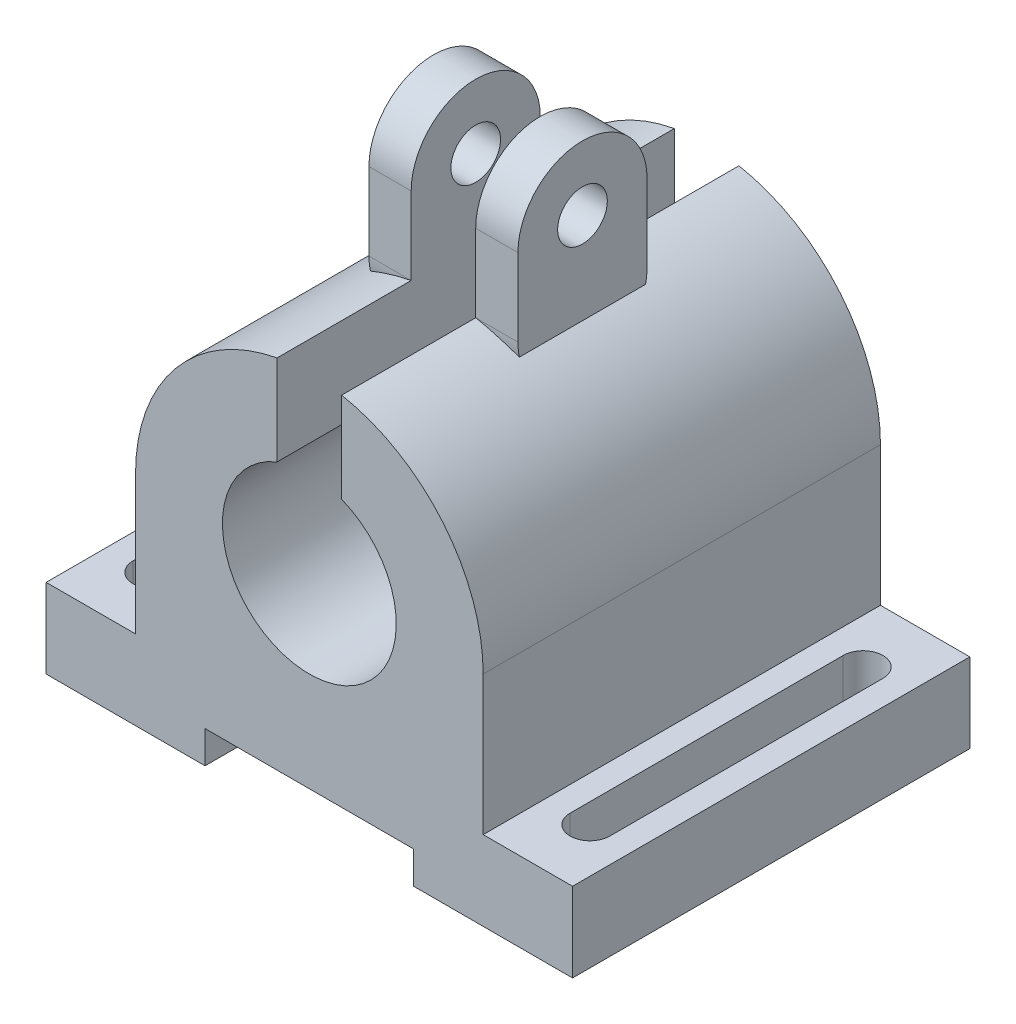
from build123d import *

# Parameters (mm, degrees)
BOSS_EXTRUDE1_DEPTH        = 80
BOSS_EXTRUDE3_DEPTH        = 8.5
BOSS_EXTRUDE4_START        = -8.5
BOSS_EXTRUDE4_DEPTH        = 8.5
F_10_0_10_DIAMETER_HOLE1_D = 10
CUT_EXTRUDE1_DEPTH         = 133.249763765


with BuildPart() as part:
    # Sketch2 → Boss-Extrude1 (new body)
    with BuildSketch(Plane.XY):
        with BuildLine():
            Line((-21, -37.5), (0, -37.5))
            Line((0, -37.5), (0, -17.5))
            ThreePointArc((0, -17.5), (-15.231429157, -8.617050879), (-15, 9.013878189))
            ThreePointArc((-15, 9.013878189), (-11.342217923, 13.326818547), (-6.5, 16.248076809))
            Line((-6.5, 16.248076809), (-6.5, 34.391132578))
            ThreePointArc((-6.5, 34.391132578), (-26.949025956, 22.332711434), (-35, 0))
            Line((-35, 0), (-35, -28))
            Line((-35, -28), (-53, -28))
            Line((-53, -28), (-53, -44))
            Line((-53, -44), (-21, -44))
            Line((-21, -44), (-21, -37.5))
        make_face()
        with BuildLine():
            Line((0, -17.5), (0, -37.5))
            Line((0, -37.5), (21, -37.5))
            Line((21, -37.5), (21, -44))
            Line((21, -44), (53, -44))
            Line((53, -44), (53, -28))
            Line((53, -28), (35, -28))
            Line((35, -28), (35, 0))
            ThreePointArc((35, 0), (26.949025956, 22.332711434), (6.5, 34.391132578))
            Line((6.5, 34.391132578), (6.5, 16.248076809))
            ThreePointArc((6.5, 16.248076809), (11.342217923, 13.326818547), (15, 9.013878189))
            ThreePointArc((15, 9.013878189), (15.231429157, -8.617050879), (0, -17.5))
        make_face()
    extrude(amount=BOSS_EXTRUDE1_DEPTH)

    # Sketch5 → Boss-Extrude3 (add)
    with BuildSketch(Plane.ZY.offset(-6.5)):
        with BuildLine():
            Line((27, 34.391132578), (27, 50))
            ThreePointArc((27, 50), (40, 63), (53, 50))
            Line((53, 50), (53, 34.391132578))
            ThreePointArc((53, 34.391132578), (40, 21.391132578), (27, 34.391132578))
        make_face()
    extrude(amount=-BOSS_EXTRUDE3_DEPTH)

    # Sketch3 → Boss-Extrude4 (add)
    with BuildSketch(Plane(origin=(-6.5, 0, 0), x_dir=(0, 0, -1), z_dir=(1, 0, 0)).offset(BOSS_EXTRUDE4_START)):
        with BuildLine():
            Line((-53, 34.391132578), (-53, 50))
            ThreePointArc((-53, 50), (-40, 63), (-27, 50))
            Line((-27, 50), (-27, 34.391132578))
            ThreePointArc((-27, 34.391132578), (-40, 21.391132578), (-53, 34.391132578))
        make_face()
    extrude(amount=BOSS_EXTRUDE4_DEPTH)

    # Ø10.0 (10) Diameter Hole1 (through all)
    with Locations(Plane(origin=(15, 50, 40), x_dir=(0, 1, 0), z_dir=(1, 0, 0))):
        with Locations((0, 0)):
            Hole(F_10_0_10_DIAMETER_HOLE1_D / 2)

    # Sketch7 → Cut-Extrude1 (cut, through all)
    with BuildSketch(Plane(origin=(0, -28, 0), x_dir=(1, 0, 0), z_dir=(0, 1, 0))):
        with BuildLine():
            Line((-40, -12.5), (-40, -67.5))
            ThreePointArc((-40, -67.5), (-44, -71.5), (-48, -67.5))
            Line((-48, -67.5), (-48, -12.5))
            ThreePointArc((-48, -12.5), (-44, -8.5), (-40, -12.5))
        make_face()
        with BuildLine():
            Line((40, -12.5), (40, -67.5))
            ThreePointArc((40, -67.5), (44, -71.5), (48, -67.5))
            Line((48, -67.5), (48, -12.5))
            ThreePointArc((48, -12.5), (44, -8.5), (40, -12.5))
        make_face()
    extrude(amount=-CUT_EXTRUDE1_DEPTH, mode=Mode.SUBTRACT)


solid = part.part
